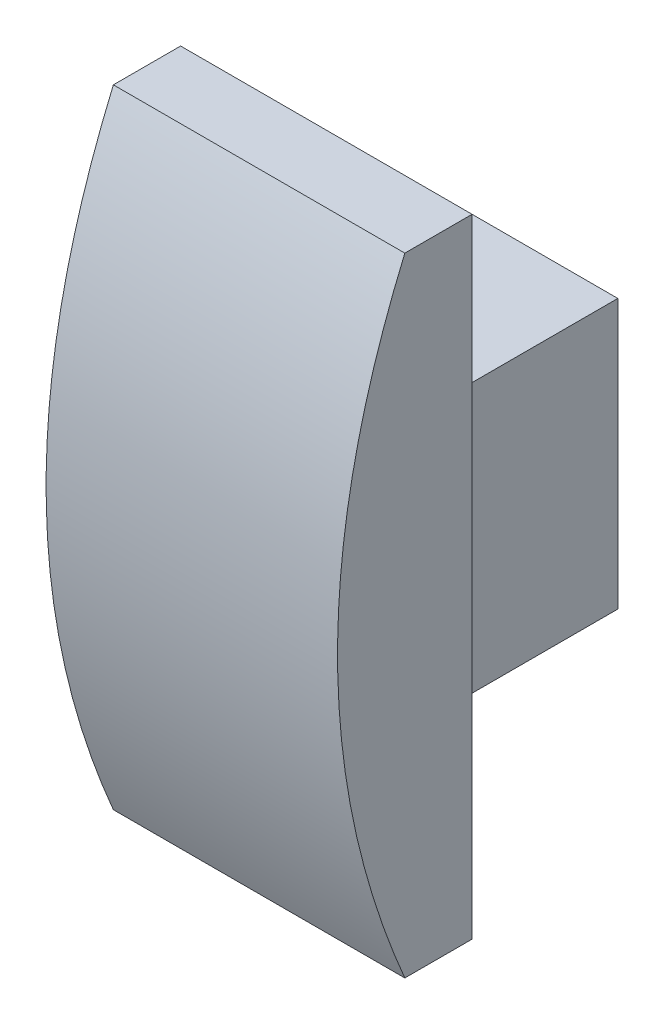
from build123d import *

# Parameters (mm, degrees)
SZKIC1_W                    = 5
SZKIC1_H                    = 6
SZKIC1_W_2                  = 2.1
SZKIC1_H_2                  = 2.1
DODANIE_WYCI_GNI_CIE1_DEPTH = 4
SZKIC3_W                    = 6.5
SZKIC3_H                    = 14
DODANIE_WYCI_GNI_CIE2_DEPTH = 3
WYTNIJ_WYCI_GNI_CIE1_DEPTH  = 13.492097502


with BuildPart() as part:
    # Szkic1 → Dodanie-wyciągnięcie1 (new body)
    with BuildSketch(Plane.XY):
        with Locations((1.05, -1.05)):
            Rectangle(SZKIC1_W, SZKIC1_H)
        with Locations((1.05, -1.05)):
            Rectangle(SZKIC1_W_2, SZKIC1_H_2, mode=Mode.SUBTRACT)
    extrude(amount=DODANIE_WYCI_GNI_CIE1_DEPTH)

    # Szkic3 → Dodanie-wyciągnięcie2 (add)
    with BuildSketch(Plane.XY.offset(4)):
        with Locations((1.05, -1.05)):
            Rectangle(SZKIC3_W, SZKIC3_H)
    extrude(amount=DODANIE_WYCI_GNI_CIE2_DEPTH)

    # Szkic4 → Wytnij-wyciągnięcie1 (cut, through all)
    with BuildSketch(Plane.ZY.offset(2.2)):
        with BuildLine():
            Line((7, -8.05), (7, -1.05))
            add(Edge.make_bspline(
                [(7, -1.05), (7, -4.55), (5.5, -8.05)],
                knots=[0.5, 0.5, 0.5, 1, 1, 1], degree=2))
            Line((5.5, -8.05), (7, -8.05))
        make_face()
        with BuildLine():
            Line((7, 5.95), (5.5, 5.95))
            add(Edge.make_bspline(
                [(5.5, 5.95), (7, 2.45), (7, -1.05)],
                knots=[0, 0, 0, 0.5, 0.5, 0.5], degree=2))
            Line((7, -1.05), (7, 5.95))
        make_face()
    extrude(amount=-WYTNIJ_WYCI_GNI_CIE1_DEPTH, mode=Mode.SUBTRACT)


solid = part.part
